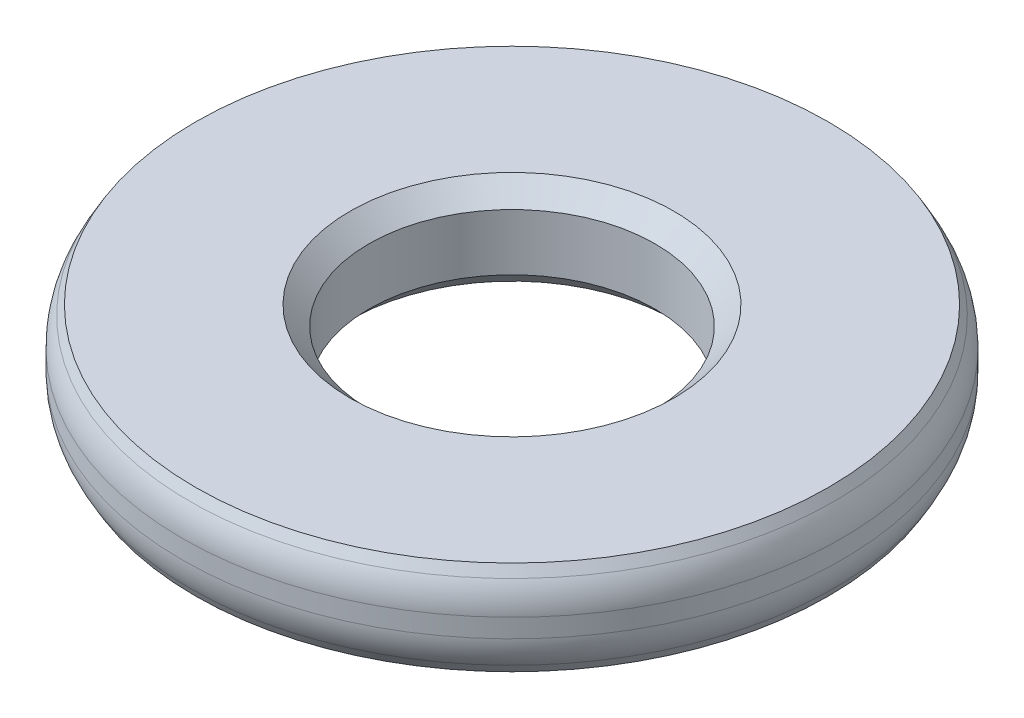
from build123d import *

# Parameters (mm, degrees)
SKETCH_1_R               = 17.5
EXTRUDE_1_DEPTH          = 5
CUT_EXTRUDE_1_DEPTH      = 26.248762346
CUT_EXTRUDE_1_DEPTH_BACK = 26.248762346
SKETCH_2_R               = 7.6
CHAMFER_1_SIZE           = 1.2
CHAMFER_1_SIZE2          = 0.692820323
FILLET_1_R               = 3
CHAMFER_2_SIZE           = 1


with BuildPart() as part:
    # 스케치1 → 보스-돌출1 (new body)
    with BuildSketch(Plane(origin=(0, 0, 0), x_dir=(1, 0, 0), z_dir=(0, 1, 0))):
        with Locations(Location((0, 0, 0), (0, 0, 270))):
            Circle(SKETCH_1_R)
    extrude(amount=EXTRUDE_1_DEPTH)

    # 스케치2 → 컷-돌출1 (cut, two sides: drawn at the far end of the back side and taken through both)
    with BuildSketch(Plane(origin=(0, 5, 0), x_dir=(1, 0, 0), z_dir=(0, 1, 0)).offset(-CUT_EXTRUDE_1_DEPTH_BACK)):
        with Locations(Location((0, 0, 0), (0, 0, 270))):
            Circle(SKETCH_2_R)
    extrude(amount=CUT_EXTRUDE_1_DEPTH + CUT_EXTRUDE_1_DEPTH_BACK, mode=Mode.SUBTRACT)

    # 모따기1
    chamfer_1_edges = [part.edges().sort_by_distance(p)[0] for p in [
        (0, 0, -17.5),
        (0, 5, -17.5),
    ]]
    chamfer_1_side = [part.faces().sort_by_distance(p)[0] for p in [
        (0, 2.5, -17.5),
    ]]
    chamfer(chamfer_1_edges, length=CHAMFER_1_SIZE, length2=CHAMFER_1_SIZE2, reference=chamfer_1_side[0])

    # 필렛1
    fillet_1_edges = [part.edges().sort_by_distance(p)[0] for p in [
        (0, 1.2, -17.5),
        (0, 3.8, -17.5),
    ]]
    fillet(fillet_1_edges, radius=FILLET_1_R)

    # 모따기2
    chamfer_2_edges = [part.edges().sort_by_distance(p)[0] for p in [
        (0, 5, -7.6),
        (0, 0, -7.6),
    ]]
    chamfer(chamfer_2_edges, length=CHAMFER_2_SIZE)


solid = part.part
